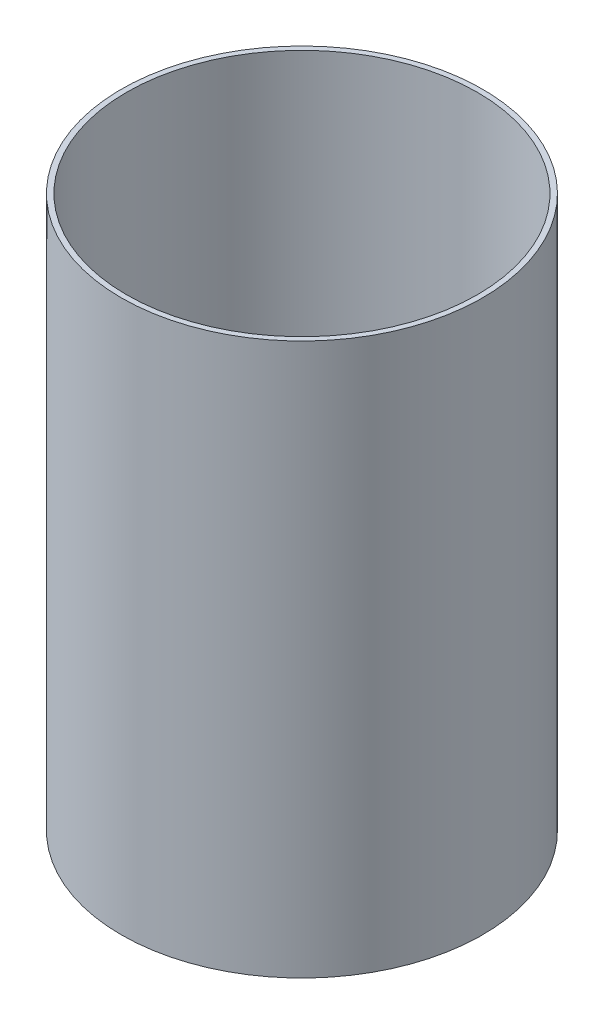
from build123d import *

# Parameters (mm, degrees)
SKETCH1_R           = 39.3
SKETCH1_R_2         = 38.15
BOSS_EXTRUDE1_DEPTH = 120


with BuildPart() as part:
    # Sketch1 → Boss-Extrude1 (new body)
    with BuildSketch(Plane(origin=(0, 0, 0), x_dir=(1, 0, 0), z_dir=(0, 1, 0))):
        with Locations(Location((0, 0, 0), (0, 0, 270))):
            Circle(SKETCH1_R)
        with Locations(Location((0, 0, 0), (0, 0, 270))):
            Circle(SKETCH1_R_2, mode=Mode.SUBTRACT)
    extrude(amount=BOSS_EXTRUDE1_DEPTH)


solid = part.part
